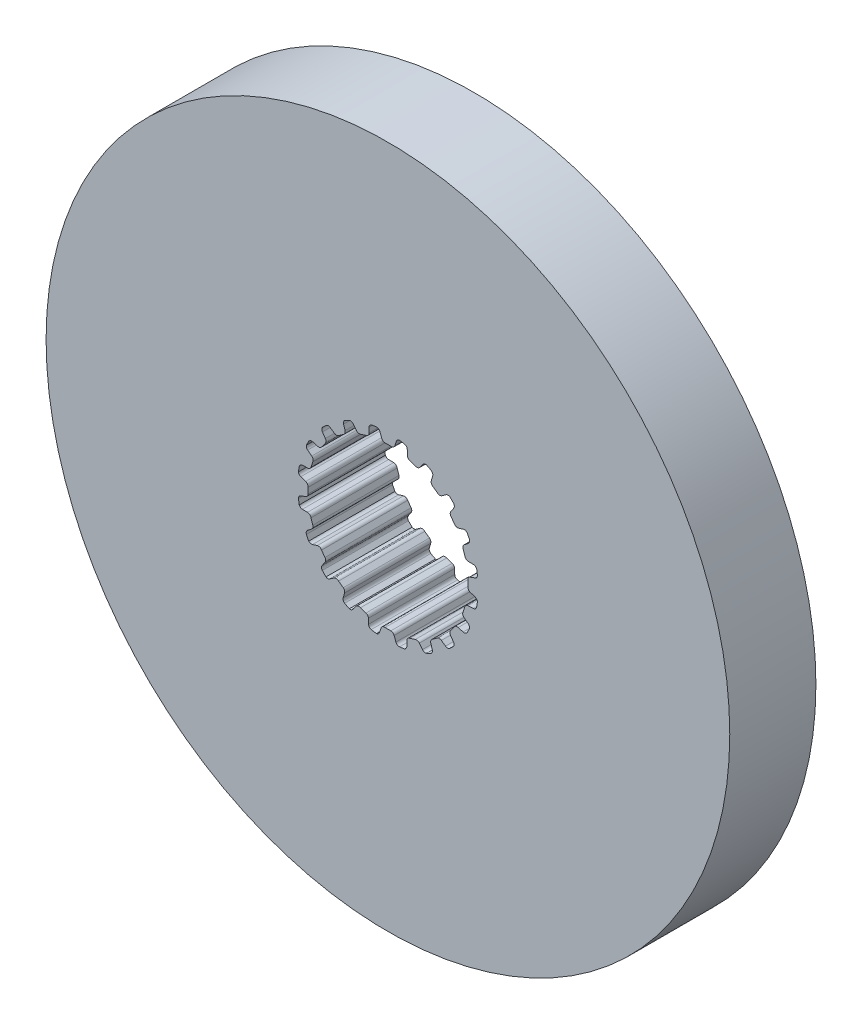
from build123d import *

# Parameters (mm, degrees)
SKETCH1_R           = 12.7
BOSS_EXTRUDE1_DEPTH = 3.2004


with BuildPart() as part:
    # Sketch1 → Boss-Extrude1 (new body)
    with BuildSketch(Plane.XY):
        Circle(SKETCH1_R)
        with BuildLine():
            Line((-0.106949245, 2.969874934), (0.106949245, 2.969874934))
            ThreePointArc((0.106949245, 2.969874934), (0.196343213, 2.986924176), (0.253739238, 3.057547504))
            Line((0.253739238, 3.057547504), (0.315888147, 3.237526941))
            ThreePointArc((0.315888147, 3.237526941), (0.359032156, 3.298322911), (0.4281449, 3.326269005))
            Line((0.4281449, 3.326269005), (0.620027588, 3.2937547))
            ThreePointArc((0.620027588, 3.2937547), (0.689621142, 3.24802576), (0.718272212, 3.169836791))
            Line((0.718272212, 3.169836791), (0.724389167, 2.979527391))
            ThreePointArc((0.724389167, 2.979527391), (0.750934762, 2.9040661), (0.816027049, 2.857568043))
            Line((0.816027049, 2.857568043), (1.019456602, 2.791469774))
            ThreePointArc((1.019456602, 2.791469774), (1.109743823, 2.780060312), (1.186154496, 2.829490741))
            Line((1.186154496, 2.829490741), (1.300878326, 2.981456288))
            ThreePointArc((1.300878326, 2.981456288), (1.360697704, 3.02594446), (1.435063648, 3.031165762))
            Line((1.435063648, 3.031165762), (1.607507455, 2.940947809))
            ThreePointArc((1.607507455, 2.940947809), (1.659563839, 2.875951412), (1.662650905, 2.792735615))
            Line((1.662650905, 2.792735615), (1.609659636, 2.609850378))
            ThreePointArc((1.609659636, 2.609850378), (1.611587176, 2.529879385), (1.659124931, 2.465542482))
            Line((1.659124931, 2.465542482), (1.832172444, 2.339816104))
            ThreePointArc((1.832172444, 2.339816104), (1.914514976, 2.301064775), (2.002460687, 2.32446371))
            Line((2.002460687, 2.32446371), (2.158529469, 2.433539921))
            ThreePointArc((2.158529469, 2.433539921), (2.229168681, 2.457365482), (2.301508367, 2.439350895))
            Line((2.301508367, 2.439350895), (2.437633293, 2.300260456))
            ThreePointArc((2.437633293, 2.300260456), (2.467056864, 2.222358901), (2.444277744, 2.14226202))
            Line((2.444277744, 2.14226202), (2.337365406, 1.984703026))
            ThreePointArc((2.337365406, 1.984703026), (2.314486209, 1.908050449), (2.339816104, 1.832172444))
            Line((2.339816104, 1.832172444), (2.465542482, 1.659124931))
            ThreePointArc((2.465542482, 1.659124931), (2.531880064, 1.596824985), (2.622752074, 1.591901975))
            Line((2.622752074, 1.591901975), (2.804888709, 1.64741171))
            ThreePointArc((2.804888709, 1.64741171), (2.879433095, 1.648242449), (2.942665411, 1.608755366))
            Line((2.942665411, 1.608755366), (3.0291466, 1.434407582))
            ThreePointArc((3.0291466, 1.434407582), (3.033057175, 1.351226417), (2.986641646, 1.282088892))
            Line((2.986641646, 1.282088892), (2.836273564, 1.165279113))
            ThreePointArc((2.836273564, 1.165279113), (2.790827206, 1.099448241), (2.791469774, 1.019456602))
            Line((2.791469774, 1.019456602), (2.857568043, 0.816027049))
            ThreePointArc((2.857568043, 0.816027049), (2.901407091, 0.736276839), (2.986310214, 0.703513784))
            Line((2.986310214, 0.703513784), (3.1766859, 0.700023363))
            ThreePointArc((3.1766859, 0.700023363), (3.247838536, 0.677777961), (3.295773863, 0.620683653))
            Line((3.295773863, 0.620683653), (3.324145932, 0.4281449))
            ThreePointArc((3.324145932, 0.4281449), (3.302160717, 0.347826477), (3.236652255, 0.29641597))
            Line((3.236652255, 0.29641597), (3.057547504, 0.231789562))
            ThreePointArc((3.057547504, 0.231789562), (2.993982591, 0.183224379), (2.969874934, 0.106949245))
            Line((2.969874934, 0.106949245), (2.969874934, -0.106949245))
            ThreePointArc((2.969874934, -0.106949245), (2.986924176, -0.196343213), (3.057547504, -0.253739238))
            Line((3.057547504, -0.253739238), (3.237526941, -0.315888147))
            ThreePointArc((3.237526941, -0.315888147), (3.298322911, -0.359032156), (3.326269005, -0.4281449))
            Line((3.326269005, -0.4281449), (3.2937547, -0.620027588))
            ThreePointArc((3.2937547, -0.620027588), (3.24802576, -0.689621142), (3.169836791, -0.718272212))
            Line((3.169836791, -0.718272212), (2.979527391, -0.724389167))
            ThreePointArc((2.979527391, -0.724389167), (2.9040661, -0.750934762), (2.857568043, -0.816027049))
            Line((2.857568043, -0.816027049), (2.791469774, -1.019456602))
            ThreePointArc((2.791469774, -1.019456602), (2.780060312, -1.109743823), (2.829490741, -1.186154496))
            Line((2.829490741, -1.186154496), (2.981456288, -1.300878326))
            ThreePointArc((2.981456288, -1.300878326), (3.02594446, -1.360697704), (3.031165762, -1.435063648))
            Line((3.031165762, -1.435063648), (2.940947809, -1.607507455))
            ThreePointArc((2.940947809, -1.607507455), (2.875951412, -1.659563839), (2.792735615, -1.662650905))
            Line((2.792735615, -1.662650905), (2.609850378, -1.609659636))
            ThreePointArc((2.609850378, -1.609659636), (2.529879385, -1.611587176), (2.465542482, -1.659124931))
            Line((2.465542482, -1.659124931), (2.339816104, -1.832172444))
            ThreePointArc((2.339816104, -1.832172444), (2.301064775, -1.914514976), (2.32446371, -2.002460687))
            Line((2.32446371, -2.002460687), (2.433539921, -2.158529469))
            ThreePointArc((2.433539921, -2.158529469), (2.457365482, -2.229168681), (2.439350895, -2.301508367))
            Line((2.439350895, -2.301508367), (2.300260456, -2.437633293))
            ThreePointArc((2.300260456, -2.437633293), (2.222358901, -2.467056864), (2.14226202, -2.444277744))
            Line((2.14226202, -2.444277744), (1.984703026, -2.337365406))
            ThreePointArc((1.984703026, -2.337365406), (1.908050449, -2.314486209), (1.832172444, -2.339816104))
            Line((1.832172444, -2.339816104), (1.659124931, -2.465542482))
            ThreePointArc((1.659124931, -2.465542482), (1.596824985, -2.531880064), (1.591901975, -2.622752074))
            Line((1.591901975, -2.622752074), (1.64741171, -2.804888709))
            ThreePointArc((1.64741171, -2.804888709), (1.648242449, -2.879433095), (1.608755366, -2.942665411))
            Line((1.608755366, -2.942665411), (1.434407582, -3.0291466))
            ThreePointArc((1.434407582, -3.0291466), (1.351226417, -3.033057175), (1.282088892, -2.986641646))
            Line((1.282088892, -2.986641646), (1.165279113, -2.836273564))
            ThreePointArc((1.165279113, -2.836273564), (1.099448241, -2.790827206), (1.019456602, -2.791469774))
            Line((1.019456602, -2.791469774), (0.816027049, -2.857568043))
            ThreePointArc((0.816027049, -2.857568043), (0.736276839, -2.901407091), (0.703513784, -2.986310214))
            Line((0.703513784, -2.986310214), (0.700023363, -3.1766859))
            ThreePointArc((0.700023363, -3.1766859), (0.677777961, -3.247838536), (0.620683653, -3.295773863))
            Line((0.620683653, -3.295773863), (0.4281449, -3.324145932))
            ThreePointArc((0.4281449, -3.324145932), (0.347826477, -3.302160717), (0.29641597, -3.236652255))
            Line((0.29641597, -3.236652255), (0.231789562, -3.057547504))
            ThreePointArc((0.231789562, -3.057547504), (0.183224379, -2.993982591), (0.106949245, -2.969874934))
            Line((0.106949245, -2.969874934), (-0.106949245, -2.969874934))
            ThreePointArc((-0.106949245, -2.969874934), (-0.196343213, -2.986924176), (-0.253739238, -3.057547504))
            Line((-0.253739238, -3.057547504), (-0.315888147, -3.237526941))
            ThreePointArc((-0.315888147, -3.237526941), (-0.359032156, -3.298322911), (-0.4281449, -3.326269005))
            Line((-0.4281449, -3.326269005), (-0.620027588, -3.2937547))
            ThreePointArc((-0.620027588, -3.2937547), (-0.689621142, -3.24802576), (-0.718272212, -3.169836791))
            Line((-0.718272212, -3.169836791), (-0.724389167, -2.979527391))
            ThreePointArc((-0.724389167, -2.979527391), (-0.750934762, -2.9040661), (-0.816027049, -2.857568043))
            Line((-0.816027049, -2.857568043), (-1.019456602, -2.791469774))
            ThreePointArc((-1.019456602, -2.791469774), (-1.109743823, -2.780060312), (-1.186154496, -2.829490741))
            Line((-1.186154496, -2.829490741), (-1.300878326, -2.981456288))
            ThreePointArc((-1.300878326, -2.981456288), (-1.360697704, -3.02594446), (-1.435063648, -3.031165762))
            Line((-1.435063648, -3.031165762), (-1.607507455, -2.940947809))
            ThreePointArc((-1.607507455, -2.940947809), (-1.659563839, -2.875951412), (-1.662650905, -2.792735615))
            Line((-1.662650905, -2.792735615), (-1.609659636, -2.609850378))
            ThreePointArc((-1.609659636, -2.609850378), (-1.611587176, -2.529879385), (-1.659124931, -2.465542482))
            Line((-1.659124931, -2.465542482), (-1.832172444, -2.339816104))
            ThreePointArc((-1.832172444, -2.339816104), (-1.914514976, -2.301064775), (-2.002460687, -2.32446371))
            Line((-2.002460687, -2.32446371), (-2.158529469, -2.433539921))
            ThreePointArc((-2.158529469, -2.433539921), (-2.229168681, -2.457365482), (-2.301508367, -2.439350895))
            Line((-2.301508367, -2.439350895), (-2.437633293, -2.300260456))
            ThreePointArc((-2.437633293, -2.300260456), (-2.467056864, -2.222358901), (-2.444277744, -2.14226202))
            Line((-2.444277744, -2.14226202), (-2.337365406, -1.984703026))
            ThreePointArc((-2.337365406, -1.984703026), (-2.314486209, -1.908050449), (-2.339816104, -1.832172444))
            Line((-2.339816104, -1.832172444), (-2.465542482, -1.659124931))
            ThreePointArc((-2.465542482, -1.659124931), (-2.531880064, -1.596824985), (-2.622752074, -1.591901975))
            Line((-2.622752074, -1.591901975), (-2.804888709, -1.64741171))
            ThreePointArc((-2.804888709, -1.64741171), (-2.879433095, -1.648242449), (-2.942665411, -1.608755366))
            Line((-2.942665411, -1.608755366), (-3.0291466, -1.434407582))
            ThreePointArc((-3.0291466, -1.434407582), (-3.033057175, -1.351226417), (-2.986641646, -1.282088892))
            Line((-2.986641646, -1.282088892), (-2.836273564, -1.165279113))
            ThreePointArc((-2.836273564, -1.165279113), (-2.790827206, -1.099448241), (-2.791469774, -1.019456602))
            Line((-2.791469774, -1.019456602), (-2.857568043, -0.816027049))
            ThreePointArc((-2.857568043, -0.816027049), (-2.901407091, -0.736276839), (-2.986310214, -0.703513784))
            Line((-2.986310214, -0.703513784), (-3.1766859, -0.700023363))
            ThreePointArc((-3.1766859, -0.700023363), (-3.247838536, -0.677777961), (-3.295773863, -0.620683653))
            Line((-3.295773863, -0.620683653), (-3.324145932, -0.4281449))
            ThreePointArc((-3.324145932, -0.4281449), (-3.302160717, -0.347826477), (-3.236652255, -0.29641597))
            Line((-3.236652255, -0.29641597), (-3.057547504, -0.231789562))
            ThreePointArc((-3.057547504, -0.231789562), (-2.993982591, -0.183224379), (-2.969874934, -0.106949245))
            Line((-2.969874934, -0.106949245), (-2.969874934, 0.106949245))
            ThreePointArc((-2.969874934, 0.106949245), (-2.986924176, 0.196343213), (-3.057547504, 0.253739238))
            Line((-3.057547504, 0.253739238), (-3.237526941, 0.315888147))
            ThreePointArc((-3.237526941, 0.315888147), (-3.298322911, 0.359032156), (-3.326269005, 0.4281449))
            Line((-3.326269005, 0.4281449), (-3.2937547, 0.620027588))
            ThreePointArc((-3.2937547, 0.620027588), (-3.24802576, 0.689621142), (-3.169836791, 0.718272212))
            Line((-3.169836791, 0.718272212), (-2.979527391, 0.724389167))
            ThreePointArc((-2.979527391, 0.724389167), (-2.9040661, 0.750934762), (-2.857568043, 0.816027049))
            Line((-2.857568043, 0.816027049), (-2.791469774, 1.019456602))
            ThreePointArc((-2.791469774, 1.019456602), (-2.780060312, 1.109743823), (-2.829490741, 1.186154496))
            Line((-2.829490741, 1.186154496), (-2.981456288, 1.300878326))
            ThreePointArc((-2.981456288, 1.300878326), (-3.02594446, 1.360697704), (-3.031165762, 1.435063648))
            Line((-3.031165762, 1.435063648), (-2.940947809, 1.607507455))
            ThreePointArc((-2.940947809, 1.607507455), (-2.875951412, 1.659563839), (-2.792735615, 1.662650905))
            Line((-2.792735615, 1.662650905), (-2.609850378, 1.609659636))
            ThreePointArc((-2.609850378, 1.609659636), (-2.529879385, 1.611587176), (-2.465542482, 1.659124931))
            Line((-2.465542482, 1.659124931), (-2.339816104, 1.832172444))
            ThreePointArc((-2.339816104, 1.832172444), (-2.301064775, 1.914514976), (-2.32446371, 2.002460687))
            Line((-2.32446371, 2.002460687), (-2.433539921, 2.158529469))
            ThreePointArc((-2.433539921, 2.158529469), (-2.457365482, 2.229168681), (-2.439350895, 2.301508367))
            Line((-2.439350895, 2.301508367), (-2.300260456, 2.437633293))
            ThreePointArc((-2.300260456, 2.437633293), (-2.222358901, 2.467056864), (-2.14226202, 2.444277744))
            Line((-2.14226202, 2.444277744), (-1.984703026, 2.337365406))
            ThreePointArc((-1.984703026, 2.337365406), (-1.908050449, 2.314486209), (-1.832172444, 2.339816104))
            Line((-1.832172444, 2.339816104), (-1.659124931, 2.465542482))
            ThreePointArc((-1.659124931, 2.465542482), (-1.596824985, 2.531880064), (-1.591901975, 2.622752074))
            Line((-1.591901975, 2.622752074), (-1.64741171, 2.804888709))
            ThreePointArc((-1.64741171, 2.804888709), (-1.648242449, 2.879433095), (-1.608755366, 2.942665411))
            Line((-1.608755366, 2.942665411), (-1.434407582, 3.0291466))
            ThreePointArc((-1.434407582, 3.0291466), (-1.351226417, 3.033057175), (-1.282088892, 2.986641646))
            Line((-1.282088892, 2.986641646), (-1.165279113, 2.836273564))
            ThreePointArc((-1.165279113, 2.836273564), (-1.099448241, 2.790827206), (-1.019456602, 2.791469774))
            Line((-1.019456602, 2.791469774), (-0.816027049, 2.857568043))
            ThreePointArc((-0.816027049, 2.857568043), (-0.736276839, 2.901407091), (-0.703513784, 2.986310214))
            Line((-0.703513784, 2.986310214), (-0.700023363, 3.1766859))
            ThreePointArc((-0.700023363, 3.1766859), (-0.677777961, 3.247838536), (-0.620683653, 3.295773863))
            Line((-0.620683653, 3.295773863), (-0.4281449, 3.324145932))
            ThreePointArc((-0.4281449, 3.324145932), (-0.347826477, 3.302160717), (-0.29641597, 3.236652255))
            Line((-0.29641597, 3.236652255), (-0.231789562, 3.057547504))
            ThreePointArc((-0.231789562, 3.057547504), (-0.183224379, 2.993982591), (-0.106949245, 2.969874934))
        make_face(mode=Mode.SUBTRACT)
    extrude(amount=BOSS_EXTRUDE1_DEPTH)


solid = part.part
